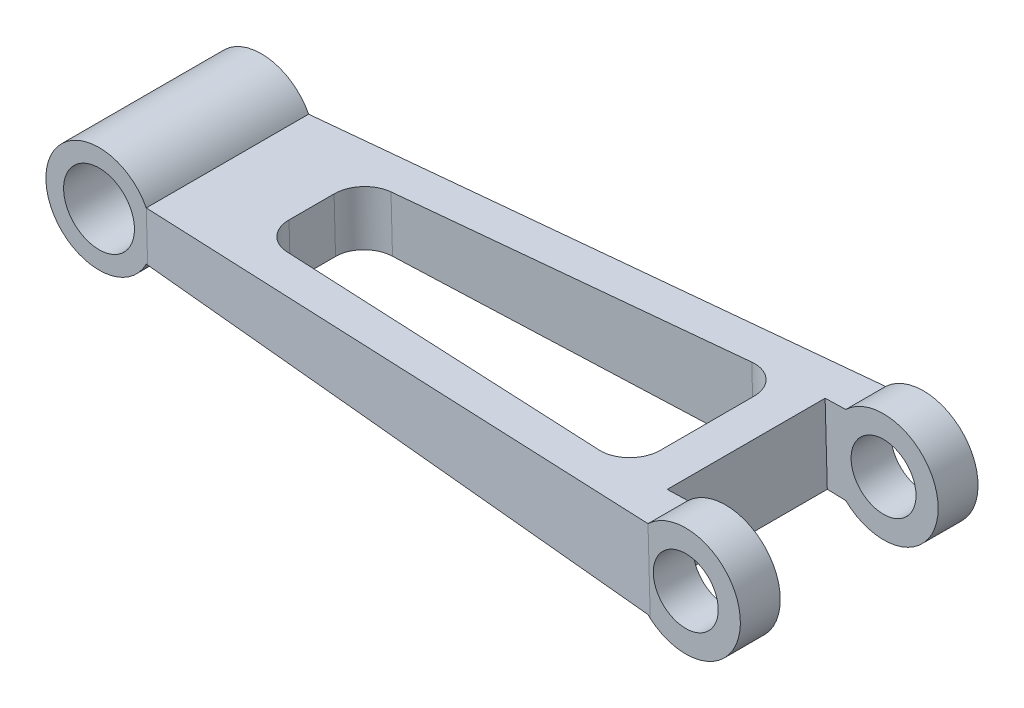
from build123d import *

# Parameters (mm, degrees)
SKETCH1_R               = 22
SKETCH1_R_2             = 24
BOSS_EXTRUDE1_DEPTH     = 161
CUT_EXTRUDE1_DEPTH      = 161
CUT_EXTRUDE1_DEPTH_BACK = 161
CUT_EXTRUDE2_DEPTH      = 161
CUT_EXTRUDE3_DEPTH      = 161
CUT_EXTRUDE3_DEPTH_BACK = 161


with BuildPart() as part:
    # Sketch1 → Boss-Extrude1 (new body)
    with BuildSketch(Plane.XY):
        with BuildLine():
            Line((-179.511953074, -16.515594264), (185.913473281, -26.726946149))
            ThreePointArc((185.913473281, -26.726946149), (248.5, 0), (185.913473281, 26.726946149))
            Line((185.913473281, 26.726946149), (-179.511953074, 16.515594264))
            ThreePointArc((-179.511953074, 16.515594264), (-247.5, 0), (-179.511953074, -16.515594264))
        make_face()
        with Locations((211.5, 0)):
            Circle(SKETCH1_R, mode=Mode.SUBTRACT)
        with Locations((-211.5, 0)):
            Circle(SKETCH1_R_2, mode=Mode.SUBTRACT)
    extrude(amount=-BOSS_EXTRUDE1_DEPTH)

    # Sketch3 → Cut-Extrude1 (cut, two sides: drawn at the far end of the back side and taken through both)
    with BuildSketch(Plane(origin=(-0.601210303, 21.515028947, 0), x_dir=(0.9996098022907813, 0.027932833085548846, 0), z_dir=(-0.027932833085548846, 0.9996098022907813, 0)).offset(-CUT_EXTRUDE1_DEPTH_BACK)):
        Polygon((-178.980580584, 135.5), (-268.840136548, 135.5), (-268.840136548, 212.571288089), (186.587489595, 212.571288089), (186.587489595, 161), align=None)
        Polygon((-178.980580584, 25.5), (-268.840136548, 25.5), (-268.840136548, -47.637415265), (186.587489595, -47.637415265), (186.587489595, 0), align=None)
    extrude(amount=CUT_EXTRUDE1_DEPTH + CUT_EXTRUDE1_DEPTH_BACK, mode=Mode.SUBTRACT)

    # Sketch4 → Cut-Extrude2 (cut)
    with BuildSketch(Plane(origin=(-0.601210303, 21.515028947, 0), x_dir=(0.9996098022907813, 0.027932833085548846, 0), z_dir=(-0.027932833085548846, 0.9996098022907813, 0))):
        with BuildLine():
            Line((-121.980580584, 65.23825231), (-121.980580584, 95.76174769))
            ThreePointArc((-121.980580584, 95.76174769), (-116.606484769, 109.402969291), (-103.372287906, 115.713267701))
            Line((-103.372287906, 115.713267701), (125.195782273, 131.656907928))
            ThreePointArc((125.195782273, 131.656907928), (140.228711197, 126.331292103), (146.587489595, 111.705387918))
            Line((146.587489595, 111.705387918), (146.587489595, 48.31804977))
            ThreePointArc((146.587489595, 48.31804977), (140.197596355, 33.6631873), (125.110990195, 28.372625495))
            Line((125.110990195, 28.372625495), (-103.457079984, 45.292828035))
            ThreePointArc((-103.457079984, 45.292828035), (-116.635443053, 51.628145551), (-121.980580584, 65.23825231))
        make_face()
    extrude(amount=-CUT_EXTRUDE2_DEPTH, mode=Mode.SUBTRACT)

    # Sketch6 → Cut-Extrude3 (cut, two sides: drawn at the far end of the back side and taken through both)
    with BuildSketch(Plane(origin=(-0.601210303, 21.515028947, 0), x_dir=(0.9996098022907813, 0.027932833085548846, 0), z_dir=(-0.027932833085548846, 0.9996098022907813, 0)).offset(-CUT_EXTRUDE3_DEPTH_BACK)):
        Polygon((172.587489595, 80.011718844), (172.587489595, 133.988681084), (279.945964302, 133.988681084), (279.945964302, 27.005225925), (172.587489595, 27.005225925), align=None)
    extrude(amount=CUT_EXTRUDE3_DEPTH + CUT_EXTRUDE3_DEPTH_BACK, mode=Mode.SUBTRACT)


solid = part.part
